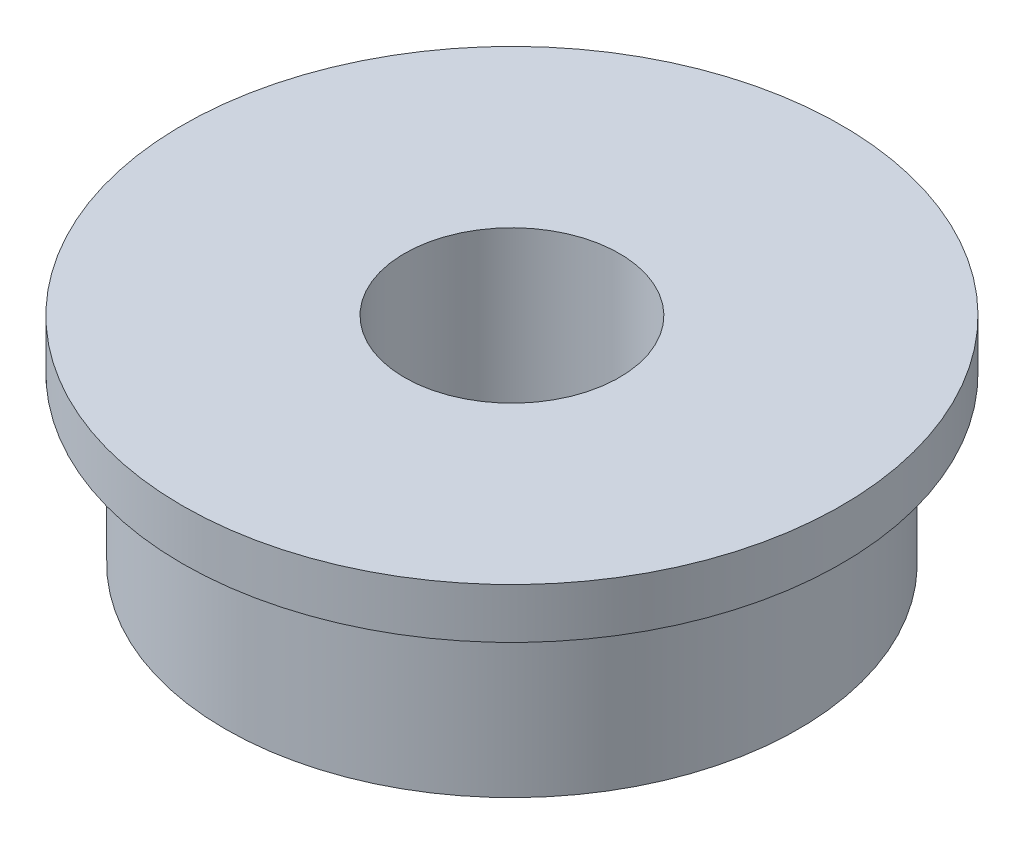
from build123d import *


with BuildPart() as part:
    # 草图2 → 旋转1 (revolve)
    with BuildSketch(Plane.XY, mode=Mode.PRIVATE) as revolve_1_sk:
        Polygon((1.5, 6.942132084), (4.6, 6.942132084), (4.6, 6.242132084), (4, 6.242132084), (4, 3.942132084), (1.5, 3.942132084), align=None)
    revolve(revolve_1_sk.sketch.rotate(Axis((0, 8.324154556, 0), (0, -1, 0)), 90), axis=Axis((0, 8.324154556, 0), (0, -1, 0)))


solid = part.part
